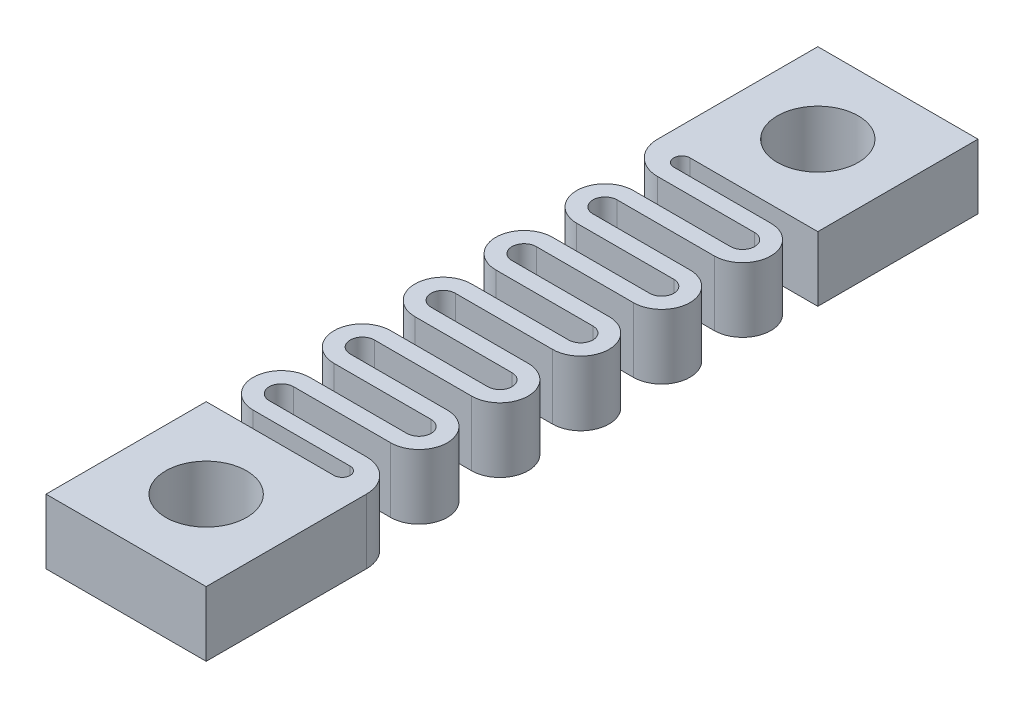
from build123d import *

# Parameters (mm, degrees)
SKETCH_1_W      = 9.9
SKETCH_1_H      = 9.9
SKETCH_1_R      = 2.5
EXTRUDE_1_DEPTH = 4
EXTRUDE_2_DEPTH = 4
SKETCH_3_W      = 9.9
SKETCH_3_H      = 9.9
SKETCH_3_R      = 2.5
EXTRUDE_3_DEPTH = 4


with BuildPart() as part:
    # 草图1 → 凸台-拉伸1 (new body)
    with BuildSketch(Plane(origin=(0, 0, 0), x_dir=(1, 0, 0), z_dir=(0, 1, 0))):
        Rectangle(SKETCH_1_W, SKETCH_1_H)
        with Locations(Location((0, 0, 0), (0, 0, 270))):
            Circle(SKETCH_1_R, mode=Mode.SUBTRACT)
    extrude(amount=EXTRUDE_1_DEPTH)

    # 草图2 → 凸台-拉伸2 (add)
    with BuildSketch(Plane(origin=(0, 0, 0), x_dir=(1, 0, 0), z_dir=(0, 1, 0))):
        with BuildLine():
            Line((3.05, -6.95), (-2.95, -6.95))
            ThreePointArc((-2.95, -6.95), (-4.364213562, -6.364213562), (-4.95, -4.95))
            Line((-4.95, -4.95), (-2.95, -4.95))
            ThreePointArc((-2.95, -4.95), (-3.45, -5.45), (-2.95, -5.95))
            Line((-2.95, -5.95), (3.05, -5.95))
            ThreePointArc((3.05, -5.95), (4.8, -7.7), (3.05, -9.45))
            Line((3.05, -9.45), (-2.95, -9.45))
            ThreePointArc((-2.95, -9.45), (-3.7, -10.2), (-2.95, -10.95))
            Line((-2.95, -10.95), (3.05, -10.95))
            ThreePointArc((3.05, -10.95), (4.8, -12.7), (3.05, -14.45))
            Line((3.05, -14.45), (-2.95, -14.45))
            ThreePointArc((-2.95, -14.45), (-3.7, -15.2), (-2.95, -15.95))
            Line((-2.95, -15.95), (3.05, -15.95))
            ThreePointArc((3.05, -15.95), (4.8, -17.7), (3.05, -19.45))
            Line((3.05, -19.45), (-2.95, -19.45))
            ThreePointArc((-2.95, -19.45), (-3.7, -20.2), (-2.95, -20.95))
            Line((-2.95, -20.95), (3.05, -20.95))
            ThreePointArc((3.05, -20.95), (4.8, -22.7), (3.05, -24.45))
            Line((3.05, -24.45), (-2.95, -24.45))
            ThreePointArc((-2.95, -24.45), (-3.7, -25.2), (-2.95, -25.95))
            Line((-2.95, -25.95), (3.05, -25.95))
            ThreePointArc((3.05, -25.95), (4.8, -27.7), (3.05, -29.45))
            Line((3.05, -29.45), (-2.95, -29.45))
            ThreePointArc((-2.95, -29.45), (-3.7, -30.2), (-2.95, -30.95))
            Line((-2.95, -30.95), (3.05, -30.95))
            ThreePointArc((3.05, -30.95), (4.464213562, -31.535786438), (5.05, -32.95))
            Line((5.05, -32.95), (3.05, -32.95))
            ThreePointArc((3.05, -32.95), (3.55, -32.45), (3.05, -31.95))
            Line((3.05, -31.95), (-2.95, -31.95))
            ThreePointArc((-2.95, -31.95), (-4.7, -30.2), (-2.95, -28.45))
            Line((-2.95, -28.45), (3.05, -28.45))
            ThreePointArc((3.05, -28.45), (3.8, -27.7), (3.05, -26.95))
            Line((3.05, -26.95), (-2.95, -26.95))
            ThreePointArc((-2.95, -26.95), (-4.7, -25.2), (-2.95, -23.45))
            Line((-2.95, -23.45), (3.05, -23.45))
            ThreePointArc((3.05, -23.45), (3.8, -22.7), (3.05, -21.95))
            Line((3.05, -21.95), (-2.95, -21.95))
            ThreePointArc((-2.95, -21.95), (-4.7, -20.2), (-2.95, -18.45))
            Line((-2.95, -18.45), (3.05, -18.45))
            ThreePointArc((3.05, -18.45), (3.8, -17.7), (3.05, -16.95))
            Line((3.05, -16.95), (-2.95, -16.95))
            ThreePointArc((-2.95, -16.95), (-4.7, -15.2), (-2.95, -13.45))
            Line((-2.95, -13.45), (3.05, -13.45))
            ThreePointArc((3.05, -13.45), (3.8, -12.7), (3.05, -11.95))
            Line((3.05, -11.95), (-2.95, -11.95))
            ThreePointArc((-2.95, -11.95), (-4.7, -10.2), (-2.95, -8.45))
            Line((-2.95, -8.45), (3.05, -8.45))
            ThreePointArc((3.05, -8.45), (3.8, -7.7), (3.05, -6.95))
        make_face()
    extrude(amount=EXTRUDE_2_DEPTH)

    # 草图3 → 凸台-拉伸3 (add)
    with BuildSketch(Plane(origin=(0, 0, 0), x_dir=(1, 0, 0), z_dir=(0, 1, 0))):
        with Locations((0.1, -37.9)):
            Rectangle(SKETCH_3_W, SKETCH_3_H)
        with Locations(Location((0.1, -37.9, 0), (0, 0, 270))):
            Circle(SKETCH_3_R, mode=Mode.SUBTRACT)
    extrude(amount=EXTRUDE_3_DEPTH)


solid = part.part
